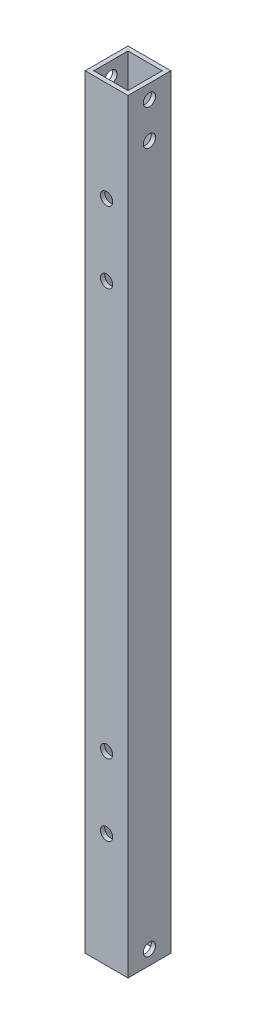
from build123d import *

# Parameters (mm, degrees)
SKETCH_1_W          = 15
SKETCH_1_H          = 15
SKETCH_1_W_2        = 12
SKETCH_1_H_2        = 12
EXTRUDE_1_DEPTH     = 267.5
SKETCH_2_R          = 2.15
CUT_EXTRUDE_1_DEPTH = 269.025185384
SKETCH_3_R          = 2.15
CUT_EXTRUDE_2_DEPTH = 269.025185384


with BuildPart() as part:
    # ｽｹｯﾁ1 → 押し出し-薄板1 (new body)
    with BuildSketch(Plane(origin=(0, 0, 0), x_dir=(1, 0, 0), z_dir=(0, 1, 0))):
        Rectangle(SKETCH_1_W, SKETCH_1_H)
        Rectangle(SKETCH_1_W_2, SKETCH_1_H_2, mode=Mode.SUBTRACT)
    extrude(amount=EXTRUDE_1_DEPTH)

    # ｽｹｯﾁ2 → ｶｯﾄ - 押し出し1 (cut, through all)
    with BuildSketch(Plane.ZY.offset(-7.5)):
        with Locations(Location((0, 5, 0), (0, 0, 180))):
            Circle(SKETCH_2_R)
        with Locations(Location((0, 262.5, 0), (0, 0, 180))):
            Circle(SKETCH_2_R)
        with Locations(Location((0, 250, 0), (0, 0, 180))):
            Circle(SKETCH_2_R)
    extrude(amount=CUT_EXTRUDE_1_DEPTH, mode=Mode.SUBTRACT)

    # ｽｹｯﾁ3 → ｶｯﾄ - 押し出し2 (cut, through all)
    with BuildSketch(Plane.XY.offset(7.5)):
        with Locations((0, 207.5)):
            Circle(SKETCH_3_R)
        with Locations((0, 232.5)):
            Circle(SKETCH_3_R)
        with Locations((0, 65)):
            Circle(SKETCH_3_R)
        with Locations((0, 40)):
            Circle(SKETCH_3_R)
    extrude(amount=-CUT_EXTRUDE_2_DEPTH, mode=Mode.SUBTRACT)


solid = part.part
